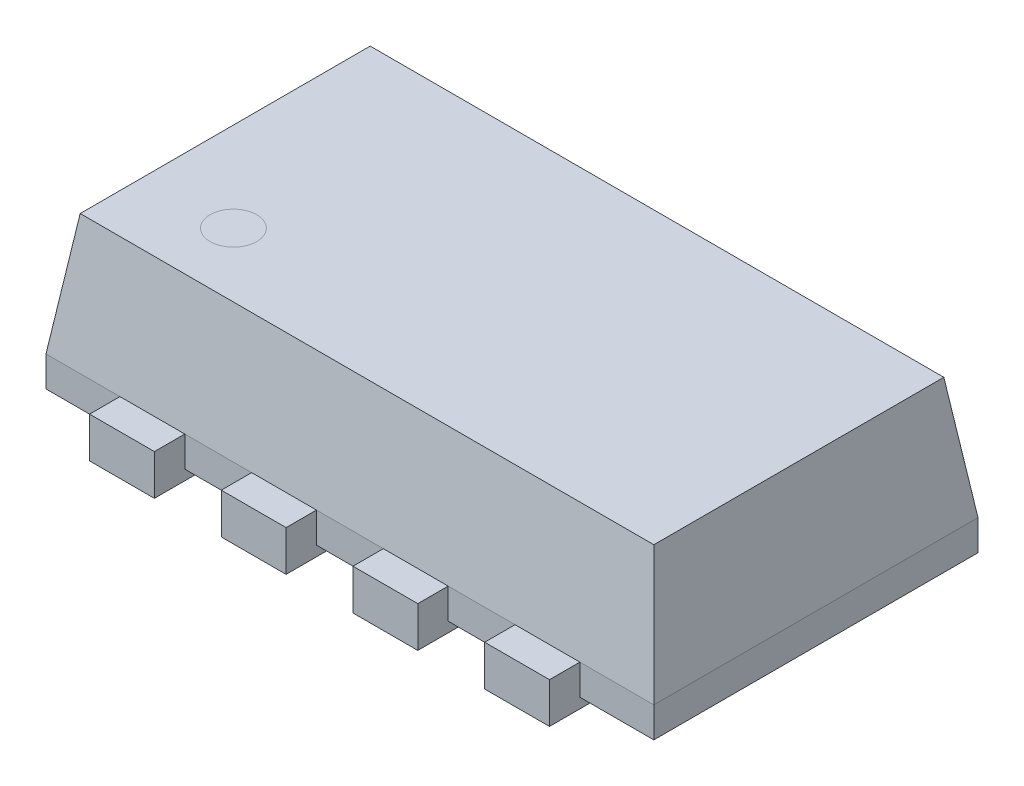
from build123d import *

# Parameters (mm, degrees)
EXTRUDE_START          = 0.05
SKETCH_1_W             = 3
SKETCH_1_H             = 1.6
EXTRUDE_1_DEPTH        = 0.15
EXTRUDE_START_2        = 0.2
SKETCH_2_W             = 3
SKETCH_2_H             = 1.6
EXTRUDE_2_DEPTH        = 0.6
EXTRUDE_2_TAPER        = 8
SKETCH_4_W             = 0.32
SKETCH_4_H             = 0.28
EXTRUDE_3_DEPTH        = 0.2
EXTRUDE_3_2_DEPTH      = 0.2
PATTERN_LINEAR_1_COUNT = 4
PATTERN_LINEAR_1_PITCH = 0.65
SKETCH_5_R             = 0.115
CUT_EXTRUDE_1_DEPTH    = 0.01
SKETCH_5_2_R           = 0.115
EXTRUDE_4_DEPTH        = 0.01


with BuildPart() as part:
    # Эскиз1 → Бобышка-Вытянуть1 (new body)
    with BuildSketch(Plane(origin=(0, 0, 0), x_dir=(1, 0, 0), z_dir=(0, 1, 0)).offset(EXTRUDE_START)):
        Rectangle(SKETCH_1_W, SKETCH_1_H)
    extrude(amount=EXTRUDE_1_DEPTH)

    # Эскиз2 → Бобышка-Вытянуть2 (add)
    with BuildSketch(Plane(origin=(0, 0, 0), x_dir=(1, 0, 0), z_dir=(0, 1, 0)).offset(EXTRUDE_START_2)):
        Rectangle(SKETCH_2_W, SKETCH_2_H)
    extrude(amount=EXTRUDE_2_DEPTH, taper=EXTRUDE_2_TAPER)


with BuildPart() as body_2:
    # Эскиз4 → Бобышка-Вытянуть3 (new body)
    with BuildSketch(Plane(origin=(0, 0, 0), x_dir=(1, 0, 0), z_dir=(0, 1, 0))):
        with Locations((-0.975, -0.81)):
            Rectangle(SKETCH_4_W, SKETCH_4_H)
    extrude_3 = extrude(amount=EXTRUDE_3_DEPTH)


with BuildPart() as body_3:
    # Эскиз4 → Extrude 3 2 (new body)
    with BuildSketch(Plane(origin=(0, 0, 0), x_dir=(1, 0, 0), z_dir=(0, 1, 0))):
        with Locations((-0.975, 0.81)):
            Rectangle(SKETCH_4_W, SKETCH_4_H)
    extrude_3_2 = extrude(amount=EXTRUDE_3_2_DEPTH)


with BuildPart() as part_1:
    add(part.part)

    # Линейный массив1: Бобышка-Вытянуть3, Extrude 3 2 ×4
    with Locations(*[(i * PATTERN_LINEAR_1_PITCH, 0, 0) for i in range(1, PATTERN_LINEAR_1_COUNT)]):
        add(extrude_3)
        add(extrude_3_2)

    # Эскиз5 → Вырез-Вытянуть1 (cut)
    with BuildSketch(Plane(origin=(0, 0.8, 0), x_dir=(1, 0, 0), z_dir=(0, 1, 0))):
        with Locations((-0.975, -0.4)):
            Circle(SKETCH_5_R)
    extrude(amount=-CUT_EXTRUDE_1_DEPTH, mode=Mode.SUBTRACT)


with BuildPart() as body_4:
    # Эскиз5<2> → Бобышка-Вытянуть4 (new body)
    with BuildSketch(Plane(origin=(0, 0.8, 0), x_dir=(1, 0, 0), z_dir=(0, 1, 0))):
        with Locations((-0.975, -0.4)):
            Circle(SKETCH_5_2_R)
    extrude(amount=-EXTRUDE_4_DEPTH)


solid = Compound([body_2.part, body_3.part, part_1.part, body_4.part])
